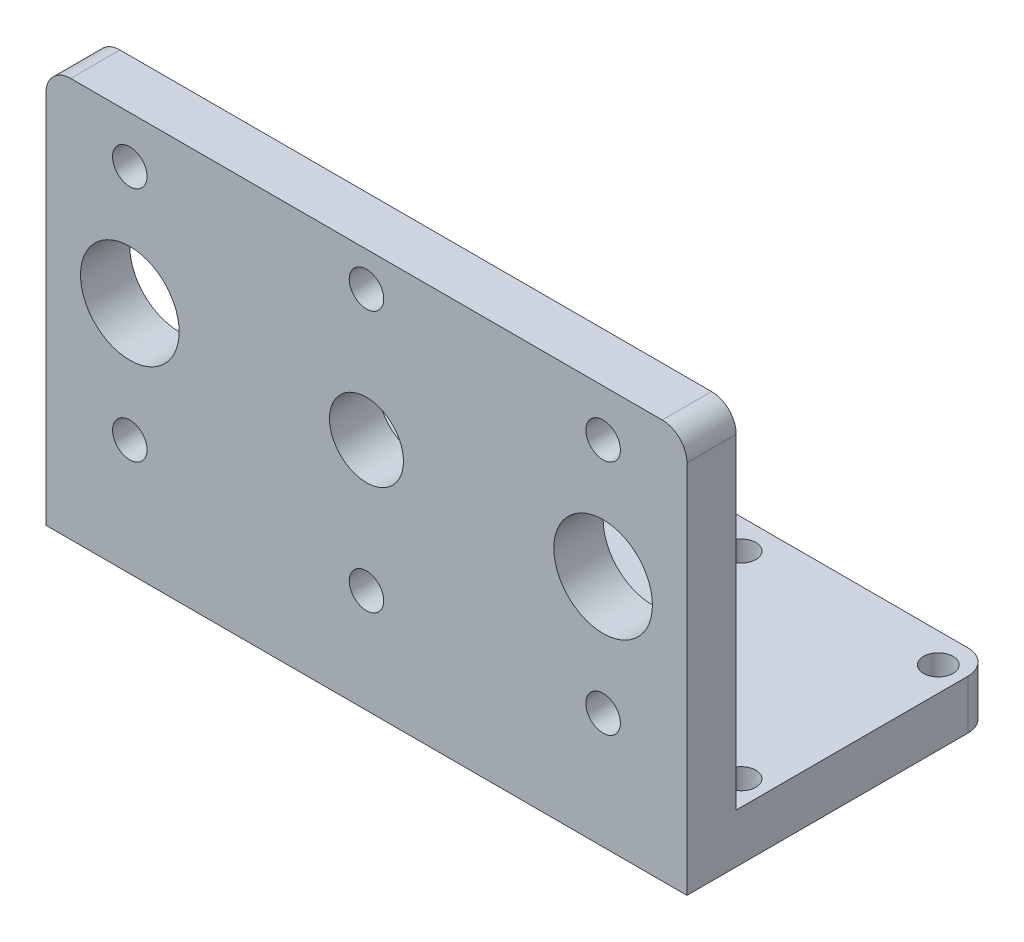
from build123d import *

# Parameters (mm, degrees)
SKETCH1_R           = 3
SKETCH1_W           = 130
SKETCH1_H           = 10
BOSS_EXTRUDE1_DEPTH = 10
SKETCH2_W           = 130
SKETCH2_H           = 8.023003322
BOSS_EXTRUDE2_DEPTH = 75
SKETCH3_R           = 7.5
SKETCH3_R_2         = 3.5
SKETCH3_R_3         = 10
CUT_EXTRUDE1_DEPTH  = 75
SKETCH4_R           = 3.5
BOSS_EXTRUDE3_DEPTH = 10
SKETCH5_R           = 3.5
CUT_EXTRUDE2_DEPTH  = 10
SKETCH7_W           = 130
SKETCH7_H           = 8.023003322
CUT_EXTRUDE3_DEPTH  = 4
FILLET2_R           = 5
SKETCH8_W           = 4.676136813
SKETCH8_H           = 81
CUT_EXTRUDE4_DEPTH  = 500
SKETCH9_R           = 3
CUT_EXTRUDE5_DEPTH  = 500
SKETCH11_W          = 130
SKETCH11_H          = 10
CUT_EXTRUDE6_DEPTH  = 40
FILLET3_R           = 5
FILLET4_R           = 5
SKETCH12_R          = 3.5
SKETCH12_R_2        = 10
SKETCH12_R_3        = 7.5
BOSS_EXTRUDE4_DEPTH = 1.98


with BuildPart() as part:
    # Sketch1 → Boss-Extrude1 (new body)
    # profile 1 of 3: a face of its own
    with BuildSketch(Plane(origin=(0, 0, 0), x_dir=(1, 0, 0), z_dir=(0, 1, 0))):
        Polygon((0, 63), (0, 0), (5, 0), (130, 0), (130, 63), align=None)
        with Locations(Location((5, 17, 0), (0, 0, 270))):
            Circle(SKETCH1_R, mode=Mode.SUBTRACT)
        with Locations(Location((45, 17, 0), (0, 0, 270))):
            Circle(SKETCH1_R, mode=Mode.SUBTRACT)
        with Locations(Location((5, 57, 0), (0, 0, 270))):
            Circle(SKETCH1_R, mode=Mode.SUBTRACT)
        with Locations(Location((45, 57, 0), (0, 0, 270))):
            Circle(SKETCH1_R, mode=Mode.SUBTRACT)
        with Locations(Location((85, 17, 0), (0, 0, 270))):
            Circle(SKETCH1_R, mode=Mode.SUBTRACT)
        with Locations(Location((125, 17, 0), (0, 0, 270))):
            Circle(SKETCH1_R, mode=Mode.SUBTRACT)
        with Locations(Location((85, 57, 0), (0, 0, 270))):
            Circle(SKETCH1_R, mode=Mode.SUBTRACT)
        with Locations(Location((125, 57, 0), (0, 0, 270))):
            Circle(SKETCH1_R, mode=Mode.SUBTRACT)
    # profile 2 of 3: a face of its own
    with BuildSketch(Plane(origin=(0, 0, 0), x_dir=(1, 0, 0), z_dir=(0, 1, 0))):
        Polygon((5, 0), (0, 0), (0, -27), (130, -27), (130, 0), align=None)
    # profile 3 of 3: a face of its own
    with BuildSketch(Plane(origin=(0, 0, 0), x_dir=(1, 0, 0), z_dir=(0, 1, 0))):
        with Locations((65, -32)):
            Rectangle(SKETCH1_W, SKETCH1_H)
    extrude(amount=BOSS_EXTRUDE1_DEPTH)

    # Sketch2 → Boss-Extrude2 (add)
    with BuildSketch(Plane(origin=(0, 10, 0), x_dir=(1, 0, 0), z_dir=(0, 1, 0))):
        with Locations((65, -32.988498339)):
            Rectangle(SKETCH2_W, SKETCH2_H)
    extrude(amount=BOSS_EXTRUDE2_DEPTH)

    # Sketch3 → Cut-Extrude1 (cut)
    with BuildSketch(Plane(origin=(0, 0, 28.976996678), x_dir=(-1, 0, 0), z_dir=(0, 0, -1))):
        with Locations((-65, 47.5)):
            Circle(SKETCH3_R)
        with Locations((-65, 74)):
            Circle(SKETCH3_R_2)
        with Locations((-17, 71.4)):
            Circle(SKETCH3_R_2)
        with Locations((-17, 23.6)):
            Circle(SKETCH3_R_2)
        with Locations((-17, 47.5)):
            Circle(SKETCH3_R_3)
        with Locations((-65, 21)):
            Circle(SKETCH3_R_2)
        with Locations((-113, 23.6)):
            Circle(SKETCH3_R_2)
        with Locations((-113, 71.4)):
            Circle(SKETCH3_R_2)
        with Locations((-113, 47.5)):
            Circle(SKETCH3_R_3)
    extrude(amount=-CUT_EXTRUDE1_DEPTH, mode=Mode.SUBTRACT)

    # Sketch4 → Boss-Extrude3 (add)
    with BuildSketch(Plane(origin=(0, 0, 28.976996678), x_dir=(-1, 0, 0), z_dir=(0, 0, -1))):
        with Locations((-17, 71.4)):
            Circle(SKETCH4_R)
        with Locations((-17, 23.6)):
            Circle(SKETCH4_R)
        with Locations((-113, 71.4)):
            Circle(SKETCH4_R)
        with Locations((-113, 23.6)):
            Circle(SKETCH4_R)
        with Locations((-65, 74)):
            Circle(SKETCH4_R)
        with Locations((-65, 21)):
            Circle(SKETCH4_R)
    extrude(amount=-BOSS_EXTRUDE3_DEPTH)

    # Sketch5 → Cut-Extrude2 (cut)
    with BuildSketch(Plane(origin=(0, 0, 28.976996678), x_dir=(-1, 0, 0), z_dir=(0, 0, -1))):
        with Locations((-113, 71.5)):
            Circle(SKETCH5_R)
        with Locations((-113, 23.5)):
            Circle(SKETCH5_R)
        with Locations((-17, 71.5)):
            Circle(SKETCH5_R)
        with Locations((-17, 23.5)):
            Circle(SKETCH5_R)
        with Locations((-65, 74)):
            Circle(SKETCH5_R)
        with Locations((-65, 21)):
            Circle(SKETCH5_R)
    extrude(amount=-CUT_EXTRUDE2_DEPTH, mode=Mode.SUBTRACT)

    # Sketch7 → Cut-Extrude3 (cut)
    with BuildSketch(Plane(origin=(0, 85, 0), x_dir=(1, 0, 0), z_dir=(0, 1, 0))):
        with Locations((65, -32.988498339)):
            Rectangle(SKETCH7_W, SKETCH7_H)
    extrude(amount=-CUT_EXTRUDE3_DEPTH, mode=Mode.SUBTRACT)

    # Fillet2
    fillet2_edges = [part.edges().sort_by_distance(p)[0] for p in [
        (130, 5, -63),
        (0, 5, -63),
        (0, 81, 32.988498339),
        (130, 81, 32.988498339),
    ]]
    fillet(fillet2_edges, radius=FILLET2_R)

    # Sketch8 → Cut-Extrude4 (cut)
    with BuildSketch(Plane.ZY):
        with Locations((39.338068406, 40.5)):
            Rectangle(SKETCH8_W, SKETCH8_H)
    extrude(amount=-CUT_EXTRUDE4_DEPTH, mode=Mode.SUBTRACT)

    # Sketch9 → Cut-Extrude5 (cut)
    with BuildSketch(Plane(origin=(0, 10, 0), x_dir=(1, 0, 0), z_dir=(0, 1, 0))):
        with Locations(Location((5, -23, 0), (0, 0, 270))):
            Circle(SKETCH9_R)
        with Locations(Location((45, -23, 0), (0, 0, 270))):
            Circle(SKETCH9_R)
        with Locations(Location((85, -23, 0), (0, 0, 270))):
            Circle(SKETCH9_R)
        with Locations(Location((125, -23, 0), (0, 0, 270))):
            Circle(SKETCH9_R)
    extrude(amount=-CUT_EXTRUDE5_DEPTH, mode=Mode.SUBTRACT)

    # Sketch11 → Cut-Extrude6 (cut)
    with BuildSketch(Plane(origin=(0, 0, -63), x_dir=(-1, 0, 0), z_dir=(0, 0, -1))):
        with Locations((-65, 5)):
            Rectangle(SKETCH11_W, SKETCH11_H)
    extrude(amount=-CUT_EXTRUDE6_DEPTH, mode=Mode.SUBTRACT)

    # Fillet3
    fillet3_edges = [part.edges().sort_by_distance(p)[0] for p in [
        (0, 5, -23),
    ]]
    fillet(fillet3_edges, radius=FILLET3_R)

    # Fillet4
    fillet4_edges = [part.edges().sort_by_distance(p)[0] for p in [
        (130, 5, -23),
    ]]
    fillet(fillet4_edges, radius=FILLET4_R)

    # Sketch12 → Boss-Extrude4 (add)
    # profile 1 of 3: a face of its own
    with BuildSketch(Plane.XY.offset(37)):
        with BuildLine():
            Line((125, 81), (5, 81))
            ThreePointArc((5, 81), (8.535533906, 79.535533906), (10, 76))
            ThreePointArc((10, 76), (5, 71), (0, 76))
            Line((0, 76), (0, 0))
            Line((0, 0), (130, 0))
            Line((130, 0), (130, 76))
            ThreePointArc((130, 76), (121.464466094, 72.464466094), (125, 81))
        make_face()
        with Locations(Location((17, 23.5, 0), (0, 0, 180))):
            Circle(SKETCH12_R, mode=Mode.SUBTRACT)
        with Locations(Location((65, 21, 0), (0, 0, 180))):
            Circle(SKETCH12_R, mode=Mode.SUBTRACT)
        with Locations(Location((113, 23.5, 0), (0, 0, 180))):
            Circle(SKETCH12_R, mode=Mode.SUBTRACT)
        with Locations(Location((17, 47.5, 0), (0, 0, 180))):
            Circle(SKETCH12_R_2, mode=Mode.SUBTRACT)
        with Locations(Location((17, 71.5, 0), (0, 0, 180))):
            Circle(SKETCH12_R, mode=Mode.SUBTRACT)
        with Locations(Location((65, 47.5, 0), (0, 0, 180))):
            Circle(SKETCH12_R_3, mode=Mode.SUBTRACT)
        with Locations(Location((113, 47.5, 0), (0, 0, 180))):
            Circle(SKETCH12_R_2, mode=Mode.SUBTRACT)
        with Locations(Location((65, 74, 0), (0, 0, 180))):
            Circle(SKETCH12_R, mode=Mode.SUBTRACT)
        with Locations(Location((113, 71.5, 0), (0, 0, 180))):
            Circle(SKETCH12_R, mode=Mode.SUBTRACT)
    # profile 2 of 3: a face of its own
    with BuildSketch(Plane.XY.offset(37)):
        with BuildLine():
            ThreePointArc((10, 76), (8.535533906, 79.535533906), (5, 81))
            ThreePointArc((5, 81), (1.464466094, 79.535533906), (0, 76))
            ThreePointArc((0, 76), (5, 71), (10, 76))
        make_face()
    # profile 3 of 3: a face of its own
    with BuildSketch(Plane.XY.offset(37)):
        with BuildLine():
            ThreePointArc((130, 76), (128.535533906, 79.535533906), (125, 81))
            ThreePointArc((125, 81), (121.464466094, 72.464466094), (130, 76))
        make_face()
    extrude(amount=BOSS_EXTRUDE4_DEPTH)


solid = part.part
